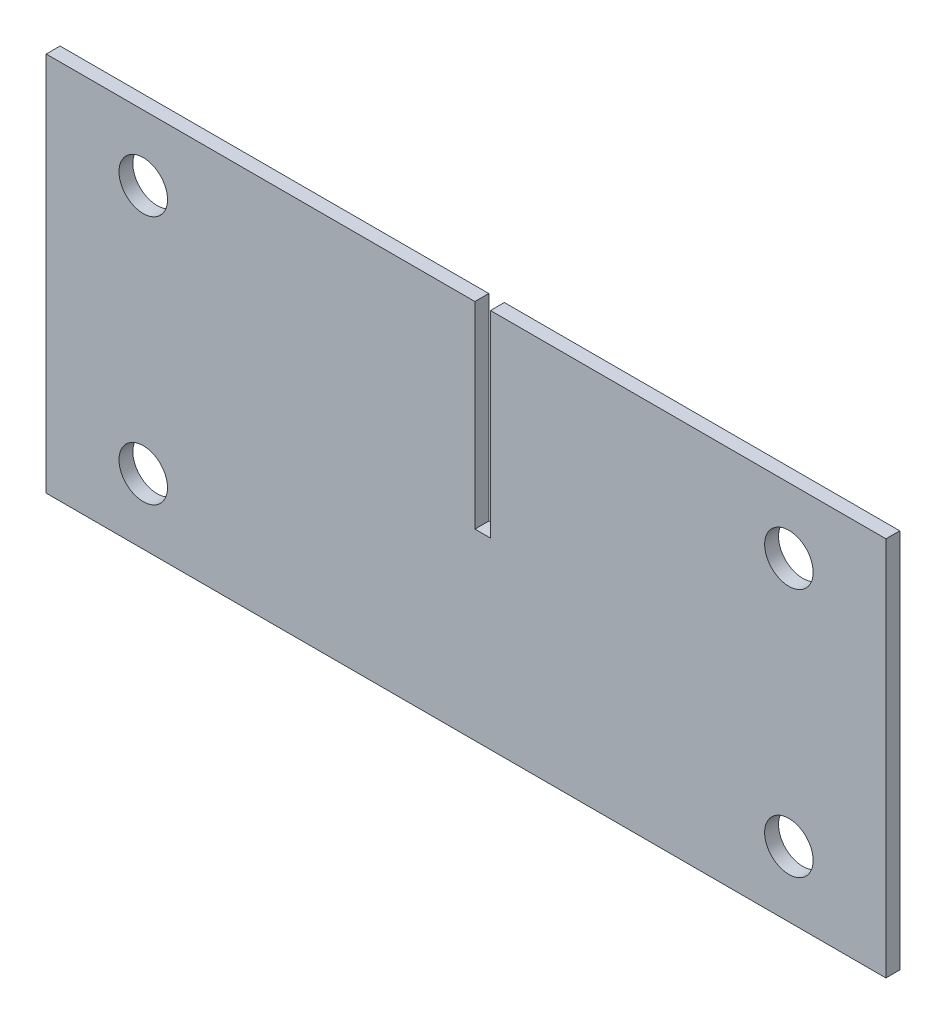
from build123d import *

# Parameters (mm, degrees)
SKETCH1_W           = 384.683
SKETCH1_H           = 174.244
BOSS_EXTRUDE1_DEPTH = 6.35
CUT_EXTRUDE1_REACH  = 1839.085
SKETCH2_R           = 11.1125
CUT_EXTRUDE2_REACH  = 1839.085
SKETCH3_W           = 7.14375
SKETCH3_H           = 90.297


with BuildPart() as part:
    # Sketch1 → Boss-Extrude1 (new body)
    with BuildSketch(Plane.XY):
        with Locations((1630.751253019, 139.093604852)):
            Rectangle(SKETCH1_W, SKETCH1_H)
    extrude(amount=BOSS_EXTRUDE1_DEPTH)

    # Sketch2 → Cut-Extrude1 (cut, up to next)
    with BuildSketch(Plane.XY.offset(6.35), mode=Mode.PRIVATE) as cut_extrude1_sk1:
        with Locations((1778.642753019, 196.243604852)):
            Circle(SKETCH2_R)
    cut_extrude1_tool1 = extrude(cut_extrude1_sk1.sketch, amount=-CUT_EXTRUDE1_REACH, mode=Mode.PRIVATE) & part.part
    # Sketch2 → Cut-Extrude1 (cut, up to next)
    with BuildSketch(Plane.XY.offset(6.35), mode=Mode.PRIVATE) as cut_extrude1_sk2:
        with Locations((1778.642753019, 81.943604852)):
            Circle(SKETCH2_R)
    cut_extrude1_tool2 = extrude(cut_extrude1_sk2.sketch, amount=-CUT_EXTRUDE1_REACH, mode=Mode.PRIVATE) & part.part
    # Sketch2 → Cut-Extrude1 (cut, up to next)
    with BuildSketch(Plane.XY.offset(6.35), mode=Mode.PRIVATE) as cut_extrude1_sk3:
        with Locations((1482.859753019, 196.243604852)):
            Circle(SKETCH2_R)
    cut_extrude1_tool3 = extrude(cut_extrude1_sk3.sketch, amount=-CUT_EXTRUDE1_REACH, mode=Mode.PRIVATE) & part.part
    # Sketch2 → Cut-Extrude1 (cut, up to next)
    with BuildSketch(Plane.XY.offset(6.35), mode=Mode.PRIVATE) as cut_extrude1_sk4:
        with Locations((1482.859753019, 81.943604852)):
            Circle(SKETCH2_R)
    cut_extrude1_tool4 = extrude(cut_extrude1_sk4.sketch, amount=-CUT_EXTRUDE1_REACH, mode=Mode.PRIVATE) & part.part
    add(cut_extrude1_tool1.solids().sort_by_distance((1778.642753, 196.243605, 6.35))[0], mode=Mode.SUBTRACT)
    add(cut_extrude1_tool2.solids().sort_by_distance((1778.642753, 81.943605, 6.35))[0], mode=Mode.SUBTRACT)
    add(cut_extrude1_tool3.solids().sort_by_distance((1482.859753, 196.243605, 6.35))[0], mode=Mode.SUBTRACT)
    add(cut_extrude1_tool4.solids().sort_by_distance((1482.859753, 81.943605, 6.35))[0], mode=Mode.SUBTRACT)

    # Sketch3 → Cut-Extrude2 (cut, up to next)
    with BuildSketch(Plane.XY.offset(6.35), mode=Mode.PRIVATE) as cut_extrude2_sk1:
        with Locations((1638.371253019, 181.067104852)):
            Rectangle(SKETCH3_W, SKETCH3_H)
    cut_extrude2_tool1 = extrude(cut_extrude2_sk1.sketch, amount=-CUT_EXTRUDE2_REACH, mode=Mode.PRIVATE) & part.part
    add(cut_extrude2_tool1.solids().sort_by_distance((1638.371253, 181.067105, 6.35))[0], mode=Mode.SUBTRACT)


solid = part.part
